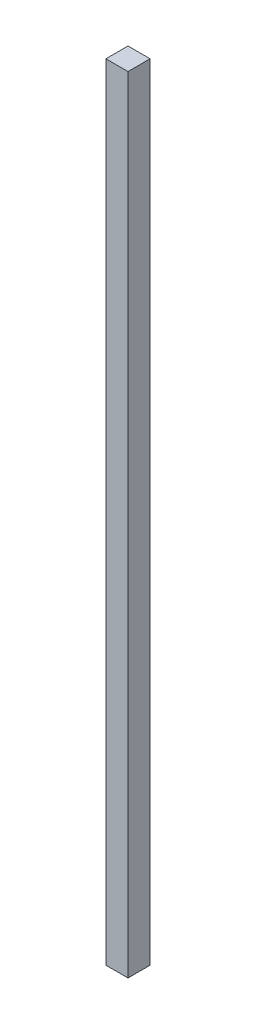
from build123d import *

# Parameters (mm, degrees)
SKETCH_1_W      = 3.1
SKETCH_1_H      = 3.1
EXTRUDE_1_DEPTH = 110


with BuildPart() as part:
    # 草图1 → 凸台-拉伸1 (new body)
    with BuildSketch(Plane(origin=(0, 0, 0), x_dir=(1, 0, 0), z_dir=(0, 1, 0))):
        with Locations((1.55, 1.55)):
            Rectangle(SKETCH_1_W, SKETCH_1_H)
    extrude(amount=EXTRUDE_1_DEPTH)


solid = part.part
